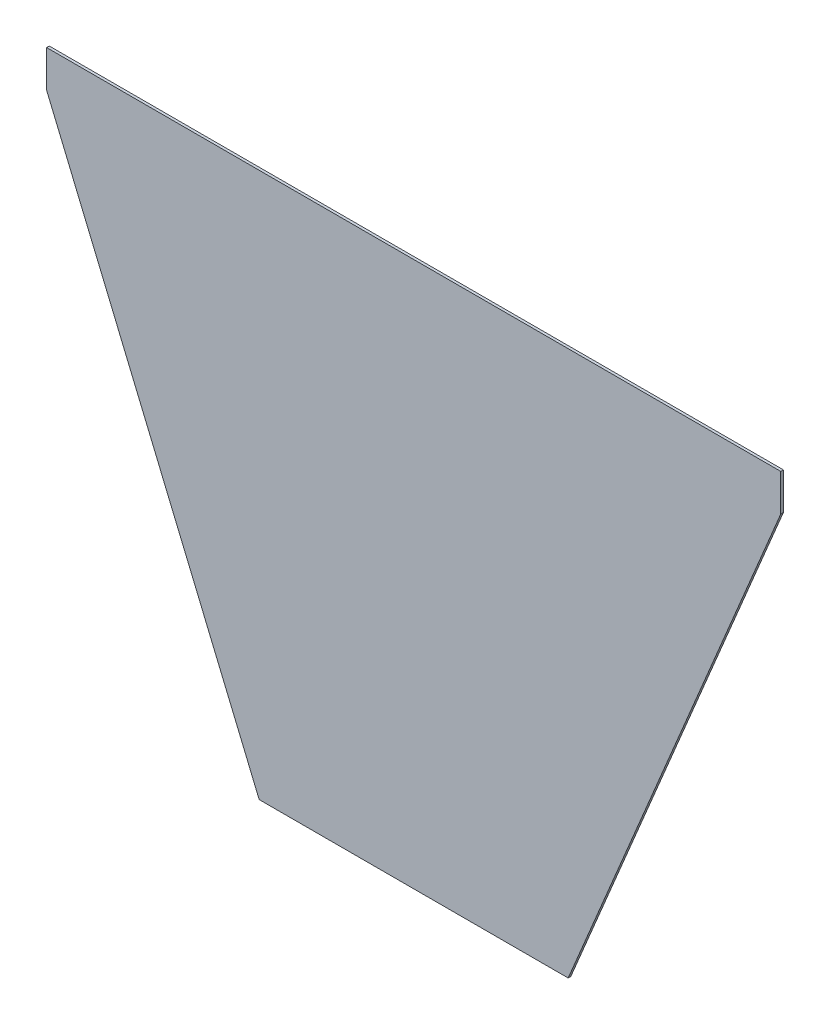
from build123d import *

# Parameters (mm, degrees)
EXTRUDE_1_DEPTH = 5


with BuildPart() as part:
    # 草图1 → 凸台-拉伸1 (new body)
    with BuildSketch(Plane.XY):
        Polygon((-695, 0), (695, 0), (695, -70), (292.5, -1032), (-292.5, -1032), (-695, -70), align=None)
    extrude(amount=EXTRUDE_1_DEPTH)


solid = part.part
